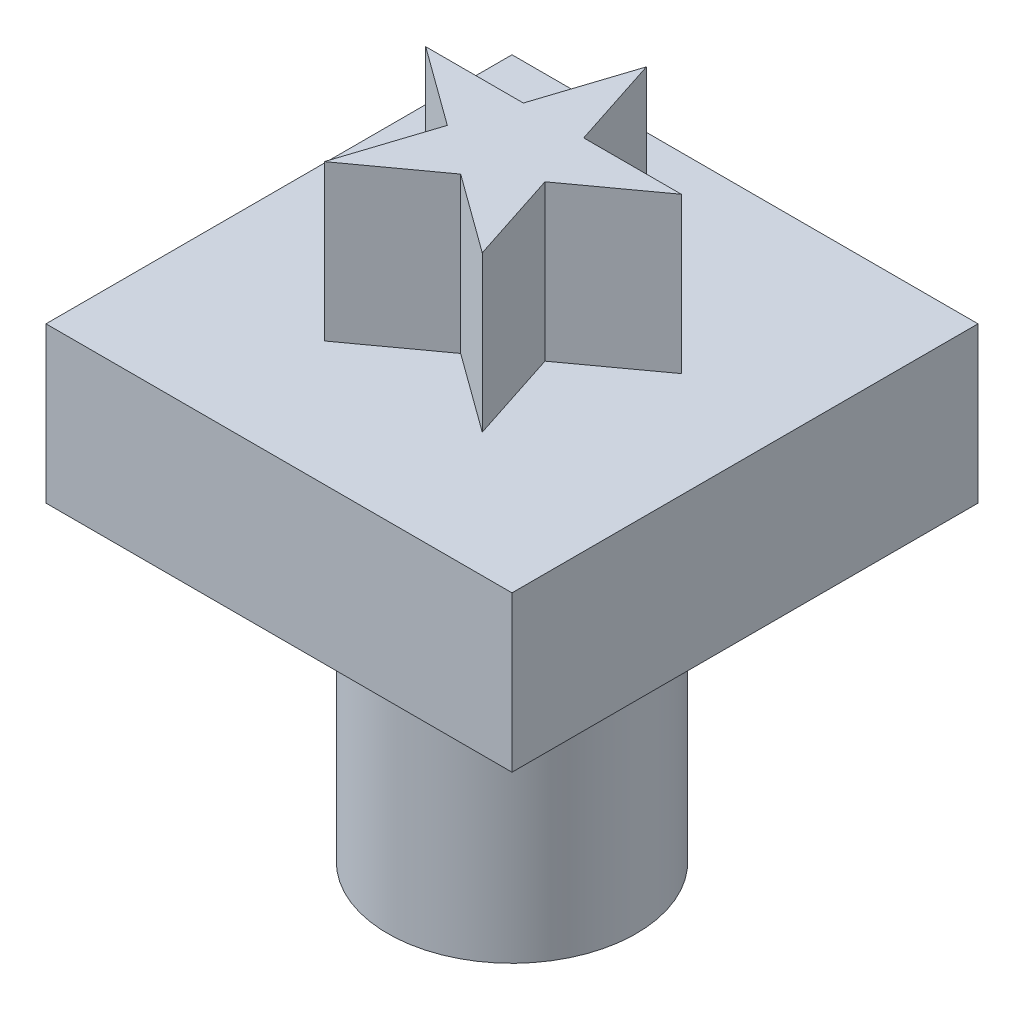
from build123d import *

# Parameters (mm, degrees)
SKETCH1_W           = 15
SKETCH1_H           = 15
BOSS_EXTRUDE1_DEPTH = 5
SKETCH5_R           = 4
BOSS_EXTRUDE3_DEPTH = 10
BOSS_EXTRUDE4_DEPTH = 5


with BuildPart() as part:
    # Sketch1 → Boss-Extrude1 (new body)
    with BuildSketch(Plane(origin=(0, 0, 0), x_dir=(1, 0, 0), z_dir=(0, 1, 0))):
        Rectangle(SKETCH1_W, SKETCH1_H)
    extrude(amount=BOSS_EXTRUDE1_DEPTH)

    # Sketch5 → Boss-Extrude3 (add)
    with BuildSketch(Plane.XZ):
        with Locations(Location((0, 0, 0), (0, 0, 270))):
            Circle(SKETCH5_R)
    extrude(amount=BOSS_EXTRUDE3_DEPTH)

    # Sketch6 → Boss-Extrude4 (add)
    with BuildSketch(Plane(origin=(0, 5, 0), x_dir=(1, 0, 0), z_dir=(0, 1, 0))):
        Polygon((-2.542898848, -3.5), (-1.571597918, -0.510643118), (-4.114496766, 1.336881039), (-0.97130093, 1.336881039), (0, 4.326237921), (0.97130093, 1.336881039), (4.114496766, 1.336881039), (1.571597918, -0.510643118), (2.542898848, -3.5), (0, -1.652475842), align=None)
    extrude(amount=BOSS_EXTRUDE4_DEPTH)


solid = part.part
